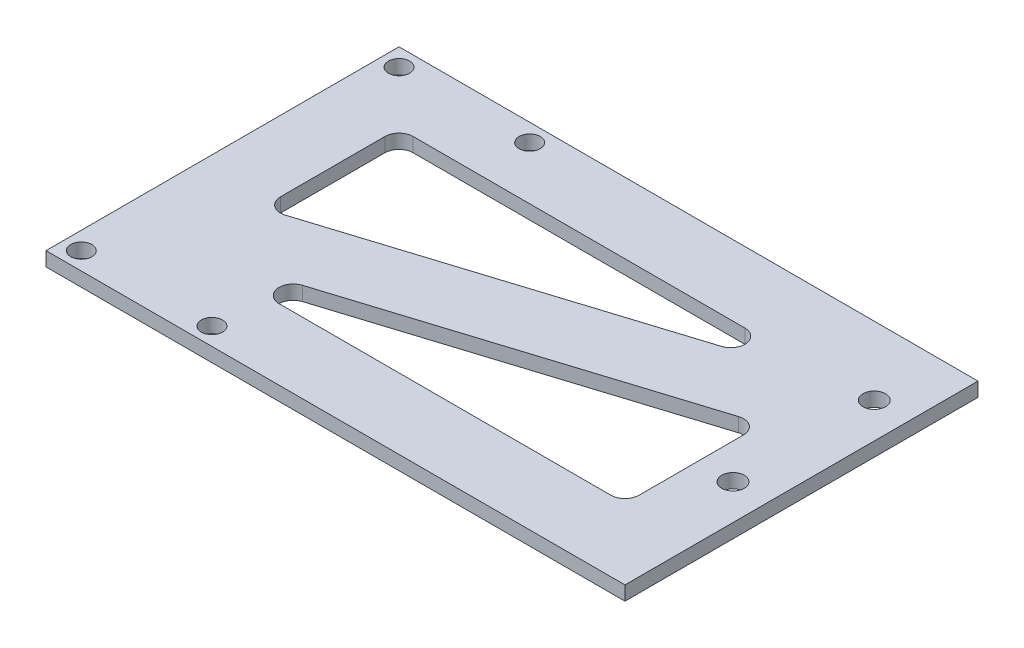
from build123d import *

# Parameters (mm, degrees)
SKETCH_1_W          = 82
SKETCH_1_H          = 50
SKETCH_1_R          = 1.5
EXTRUDE_1_DEPTH     = 2
SKETCH_2_R          = 1.6
CUT_EXTRUDE_1_DEPTH = 2
CUT_EXTRUDE_2_DEPTH = 2
FILLET_1_R          = 2


with BuildPart() as part:
    # 草图1 → 凸台-拉伸1 (new body)
    with BuildSketch(Plane(origin=(0, 0, 0), x_dir=(1, 0, 0), z_dir=(0, 1, 0))):
        with Locations((41, 25)):
            Rectangle(SKETCH_1_W, SKETCH_1_H)
        with Locations(Location((2.5, 47.5, 0), (0, 0, 270))):
            Circle(SKETCH_1_R, mode=Mode.SUBTRACT)
        with Locations(Location((2.5, 2.5, 0), (0, 0, 270))):
            Circle(SKETCH_1_R, mode=Mode.SUBTRACT)
        with Locations(Location((21, 47.5, 0), (0, 0, 270))):
            Circle(SKETCH_1_R, mode=Mode.SUBTRACT)
        with Locations(Location((21, 2.5, 0), (0, 0, 270))):
            Circle(SKETCH_1_R, mode=Mode.SUBTRACT)
    extrude(amount=EXTRUDE_1_DEPTH)

    # 草图2 → 切除-拉伸1 (cut)
    with BuildSketch(Plane(origin=(0, 2, 0), x_dir=(1, 0, 0), z_dir=(0, 1, 0))):
        with Locations(Location((77, 20.3, 0), (0, 0, 270))):
            Circle(SKETCH_2_R)
        with Locations(Location((77, 40.3, 0), (0, 0, 270))):
            Circle(SKETCH_2_R)
    extrude(amount=-CUT_EXTRUDE_1_DEPTH, mode=Mode.SUBTRACT)

    # 草图4 → 切除-拉伸2 (cut)
    with BuildSketch(Plane(origin=(0, 2, 0), x_dir=(1, 0, 0), z_dir=(0, 1, 0))):
        Polygon((10, 10), (72, 10), (72, 29.516271877), align=None)
        Polygon((10, 20.483728123), (10, 40), (72, 40), align=None)
    extrude(amount=-CUT_EXTRUDE_2_DEPTH, mode=Mode.SUBTRACT)

    # 圆角1
    fillet_1_edges = [part.edges().sort_by_distance(p)[0] for p in [
        (72, 1, -40),
        (10, 1, -20.483728123),
        (10, 1, -40),
        (10, 1, -10),
        (72, 1, -29.516271877),
        (72, 1, -10),
    ]]
    fillet(fillet_1_edges, radius=FILLET_1_R)


solid = part.part
